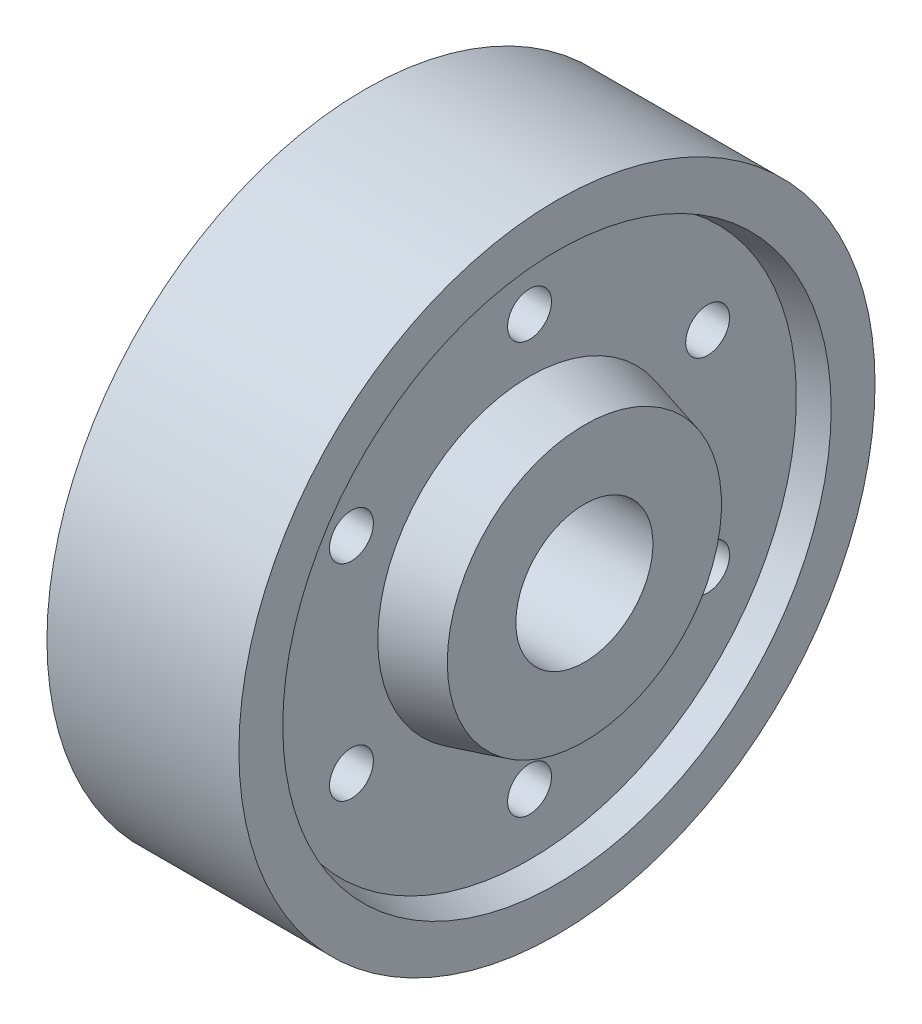
from build123d import *

# Parameters (mm, degrees)
SKETCH5_R          = 4
CUT_EXTRUDE1_DEPTH = 35


with BuildPart() as part:
    # Sketch1 → Revolve2 (revolve)
    with BuildSketch(Plane(origin=(0, 0, 0), x_dir=(1, 0, 0), z_dir=(0, 1, 0)), mode=Mode.PRIVATE) as revolve2_sk:
        Polygon((45, 12.5), (45, 25), (40, 26.339745962), (35, 27.679491924), (35, 48.660254038), (40, 50), (40, 58), (5, 58), (5, 50), (10, 48.660254038), (10, 27.679491924), (5, 26.339745962), (0, 25), (0, 12.5), align=None)
    revolve(revolve2_sk.sketch.rotate(Axis((0, 0, 0), (1, 0, 0)), 180), axis=Axis((0, 0, 0), (1, 0, 0)))

    # Sketch5 → Cut-Extrude1 (cut)
    with BuildSketch(Plane(origin=(45, 0, 0), x_dir=(0, 0, -1), z_dir=(1, 0, 0))):
        with Locations((0, 37.5)):
            Circle(SKETCH5_R)
        with Locations((32.475952642, 18.75)):
            Circle(SKETCH5_R)
        with Locations((32.475952642, -18.75)):
            Circle(SKETCH5_R)
        with Locations((0, -37.5)):
            Circle(SKETCH5_R)
        with Locations((-32.475952642, -18.75)):
            Circle(SKETCH5_R)
        with Locations((-32.475952642, 18.75)):
            Circle(SKETCH5_R)
    extrude(amount=-CUT_EXTRUDE1_DEPTH, mode=Mode.SUBTRACT)


solid = part.part
